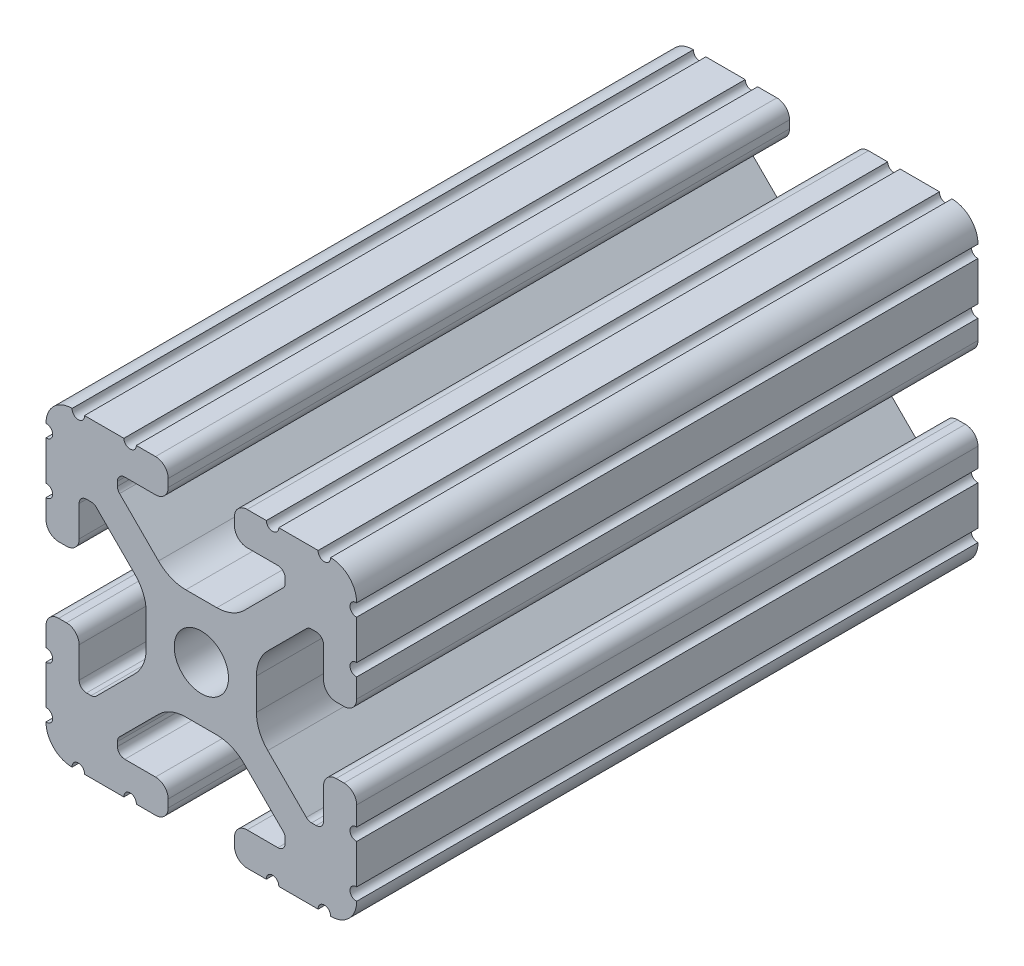
from build123d import *

# Parameters (mm, degrees)
SKETCH1_R      = 3.3274
EXTRUDE1_DEPTH = 76.2


with BuildPart() as part:
    # Sketch1 → Extrude1 (new body)
    with BuildSketch(Plane.XY):
        with BuildLine():
            Line((-10.022898969, 12.91475973), (-5.252158105, 8.144007132))
            ThreePointArc((-5.252158105, 8.144007132), (-3.715177372, 7.117027388), (-1.902183975, 6.7564))
            Line((-1.902183975, 6.7564), (1.902183975, 6.7564))
            ThreePointArc((1.902183975, 6.7564), (3.715177372, 7.117027388), (5.252158105, 8.144007132))
            Line((5.252158105, 8.144007132), (10.022898969, 12.91475973))
            ThreePointArc((10.022898969, 12.91475973), (10.218362387, 13.207291992), (10.287, 13.552357131))
            Line((10.287, 13.552357131), (10.287, 14.0843))
            ThreePointArc((10.287, 14.0843), (10.022898185, 14.721898185), (9.3853, 14.986))
            Line((9.3853, 14.986), (5.617617549, 14.986))
            ThreePointArc((5.617617549, 14.986), (4.519044045, 15.441044045), (4.064, 16.539617549))
            Line((4.064, 16.539617549), (4.064, 17.496382451))
            ThreePointArc((4.064, 17.496382451), (4.519044045, 18.594955955), (5.617617549, 19.05))
            Line((5.617617549, 19.05), (7.974178704, 19.05))
            ThreePointArc((7.974178704, 19.05), (8.736178704, 18.288), (9.498178704, 19.05))
            Line((9.498178704, 19.05), (14.327719207, 19.05))
            ThreePointArc((14.327719207, 19.05), (15.087603123, 18.231251131), (15.847487039, 19.05))
            ThreePointArc((15.847487039, 19.05), (18.120176289, 18.120192083), (19.05, 15.847509295))
            ThreePointArc((19.05, 15.847509295), (18.231250992, 15.08762539), (19.05, 14.327741484))
            Line((19.05, 14.327741484), (19.05, 9.496091471))
            ThreePointArc((19.05, 9.496091471), (18.231250992, 8.736207565), (19.05, 7.97632366))
            Line((19.05, 7.97632366), (19.05, 5.617617549))
            ThreePointArc((19.05, 5.617617549), (18.594955955, 4.519044045), (17.496382451, 4.064))
            Line((17.496382451, 4.064), (16.539617549, 4.064))
            ThreePointArc((16.539617549, 4.064), (15.441044045, 4.519044045), (14.986, 5.617617549))
            Line((14.986, 5.617617549), (14.986, 9.385342516))
            ThreePointArc((14.986, 9.385342516), (14.721898185, 10.022940701), (14.0843, 10.287042516))
            Line((14.0843, 10.287042516), (13.516042086, 10.287042516))
            ThreePointArc((13.516042086, 10.287042516), (13.170975923, 10.218404478), (12.878443117, 10.022939917))
            Line((12.878443117, 10.022939917), (8.14758008, 5.292065243))
            ThreePointArc((8.14758008, 5.292065243), (7.117955879, 3.751120653), (6.7564, 1.933453584))
            Line((6.7564, 1.933453584), (6.7564, -1.933453584))
            ThreePointArc((6.7564, -1.933453584), (7.117955879, -3.751120653), (8.14758008, -5.292065243))
            Line((8.14758008, -5.292065243), (12.878443117, -10.022939917))
            ThreePointArc((12.878443117, -10.022939917), (13.170975923, -10.218404478), (13.516042086, -10.287042516))
            Line((13.516042086, -10.287042516), (14.0843, -10.287042516))
            ThreePointArc((14.0843, -10.287042516), (14.721898185, -10.022940701), (14.986, -9.385342516))
            Line((14.986, -9.385342516), (14.986, -5.617617549))
            ThreePointArc((14.986, -5.617617549), (15.441044045, -4.519044045), (16.539617549, -4.064))
            Line((16.539617549, -4.064), (17.496382451, -4.064))
            ThreePointArc((17.496382451, -4.064), (18.594955955, -4.519044045), (19.05, -5.617617549))
            Line((19.05, -5.617617549), (19.05, -7.976318491))
            ThreePointArc((19.05, -7.976318491), (18.231250992, -8.736202396), (19.05, -9.496086302))
            Line((19.05, -9.496086302), (19.05, -14.32774291))
            ThreePointArc((19.05, -14.32774291), (18.231250992, -15.087626816), (19.05, -15.847510721))
            ThreePointArc((19.05, -15.847510721), (18.120175716, -18.120192644), (15.847486868, -19.05))
            ThreePointArc((15.847486868, -19.05), (15.087602952, -18.231251131), (14.327719036, -19.05))
            Line((14.327719036, -19.05), (9.496062448, -19.05))
            ThreePointArc((9.496062448, -19.05), (8.736178532, -18.231251131), (7.976294616, -19.05))
            Line((7.976294616, -19.05), (5.617617549, -19.05))
            ThreePointArc((5.617617549, -19.05), (4.519044045, -18.594955955), (4.064, -17.496382451))
            Line((4.064, -17.496382451), (4.064, -16.539617549))
            ThreePointArc((4.064, -16.539617549), (4.519044045, -15.441044045), (5.617617549, -14.986))
            Line((5.617617549, -14.986), (9.3853, -14.986))
            ThreePointArc((9.3853, -14.986), (10.022898185, -14.721898185), (10.287, -14.0843))
            Line((10.287, -14.0843), (10.287, -13.552357131))
            ThreePointArc((10.287, -13.552357131), (10.218362387, -13.207291992), (10.022898969, -12.91475973))
            Line((10.022898969, -12.91475973), (5.252158105, -8.144007132))
            ThreePointArc((5.252158105, -8.144007132), (3.715177372, -7.117027388), (1.902183975, -6.7564))
            Line((1.902183975, -6.7564), (-1.902183975, -6.7564))
            ThreePointArc((-1.902183975, -6.7564), (-3.715177372, -7.117027388), (-5.252158105, -8.144007132))
            Line((-5.252158105, -8.144007132), (-10.022898969, -12.91475973))
            ThreePointArc((-10.022898969, -12.91475973), (-10.218362387, -13.207291992), (-10.287, -13.552357131))
            Line((-10.287, -13.552357131), (-10.287, -14.0843))
            ThreePointArc((-10.287, -14.0843), (-10.022898185, -14.721898185), (-9.3853, -14.986))
            Line((-9.3853, -14.986), (-5.617617549, -14.986))
            ThreePointArc((-5.617617549, -14.986), (-4.519044045, -15.441044045), (-4.064, -16.539617549))
            Line((-4.064, -16.539617549), (-4.064, -17.496382451))
            ThreePointArc((-4.064, -17.496382451), (-4.519044045, -18.594955955), (-5.617617549, -19.05))
            Line((-5.617617549, -19.05), (-7.976294616, -19.05))
            ThreePointArc((-7.976294616, -19.05), (-8.736178532, -18.231251131), (-9.496062448, -19.05))
            Line((-9.496062448, -19.05), (-14.327719036, -19.05))
            ThreePointArc((-14.327719036, -19.05), (-15.087602952, -18.231251131), (-15.847486868, -19.05))
            ThreePointArc((-15.847486868, -19.05), (-18.120175716, -18.120192644), (-19.05, -15.847510721))
            ThreePointArc((-19.05, -15.847510721), (-18.231250992, -15.087626816), (-19.05, -14.32774291))
            Line((-19.05, -14.32774291), (-19.05, -9.496086302))
            ThreePointArc((-19.05, -9.496086302), (-18.231250992, -8.736202396), (-19.05, -7.976318491))
            Line((-19.05, -7.976318491), (-19.05, -5.617617549))
            ThreePointArc((-19.05, -5.617617549), (-18.594955955, -4.519044045), (-17.496382451, -4.064))
            Line((-17.496382451, -4.064), (-16.539617549, -4.064))
            ThreePointArc((-16.539617549, -4.064), (-15.441044045, -4.519044045), (-14.986, -5.617617549))
            Line((-14.986, -5.617617549), (-14.986, -9.385342516))
            ThreePointArc((-14.986, -9.385342516), (-14.721898185, -10.022940701), (-14.0843, -10.287042516))
            Line((-14.0843, -10.287042516), (-13.516042086, -10.287042516))
            ThreePointArc((-13.516042086, -10.287042516), (-13.170975923, -10.218404478), (-12.878443117, -10.022939917))
            Line((-12.878443117, -10.022939917), (-8.14758008, -5.292065243))
            ThreePointArc((-8.14758008, -5.292065243), (-7.117955879, -3.751120653), (-6.7564, -1.933453584))
            Line((-6.7564, -1.933453584), (-6.7564, 1.933453584))
            ThreePointArc((-6.7564, 1.933453584), (-7.117955879, 3.751120653), (-8.14758008, 5.292065243))
            Line((-8.14758008, 5.292065243), (-12.878443117, 10.022939917))
            ThreePointArc((-12.878443117, 10.022939917), (-13.170975923, 10.218404478), (-13.516042086, 10.287042516))
            Line((-13.516042086, 10.287042516), (-14.0843, 10.287042516))
            ThreePointArc((-14.0843, 10.287042516), (-14.721898185, 10.022940701), (-14.986, 9.385342516))
            Line((-14.986, 9.385342516), (-14.986, 5.617617549))
            ThreePointArc((-14.986, 5.617617549), (-15.441044045, 4.519044045), (-16.539617549, 4.064))
            Line((-16.539617549, 4.064), (-17.496382451, 4.064))
            ThreePointArc((-17.496382451, 4.064), (-18.594955955, 4.519044045), (-19.05, 5.617617549))
            Line((-19.05, 5.617617549), (-19.05, 7.97632366))
            ThreePointArc((-19.05, 7.97632366), (-18.231250992, 8.736207565), (-19.05, 9.496091471))
            Line((-19.05, 9.496091471), (-19.05, 14.327741484))
            ThreePointArc((-19.05, 14.327741484), (-18.231250992, 15.08762539), (-19.05, 15.847509295))
            ThreePointArc((-19.05, 15.847509295), (-18.120176289, 18.120192083), (-15.847487039, 19.05))
            ThreePointArc((-15.847487039, 19.05), (-15.087603123, 18.231251131), (-14.327719207, 19.05))
            Line((-14.327719207, 19.05), (-9.498178704, 19.05))
            ThreePointArc((-9.498178704, 19.05), (-8.736178704, 18.288), (-7.974178704, 19.05))
            Line((-7.974178704, 19.05), (-5.617617549, 19.05))
            ThreePointArc((-5.617617549, 19.05), (-4.519044045, 18.594955955), (-4.064, 17.496382451))
            Line((-4.064, 17.496382451), (-4.064, 16.539617549))
            ThreePointArc((-4.064, 16.539617549), (-4.519044045, 15.441044045), (-5.617617549, 14.986))
            Line((-5.617617549, 14.986), (-9.3853, 14.986))
            ThreePointArc((-9.3853, 14.986), (-10.022898185, 14.721898185), (-10.287, 14.0843))
            Line((-10.287, 14.0843), (-10.287, 13.552357131))
            ThreePointArc((-10.287, 13.552357131), (-10.218362387, 13.207291992), (-10.022898969, 12.91475973))
        make_face()
        Circle(SKETCH1_R, mode=Mode.SUBTRACT)
    extrude(amount=-EXTRUDE1_DEPTH)


solid = part.part
